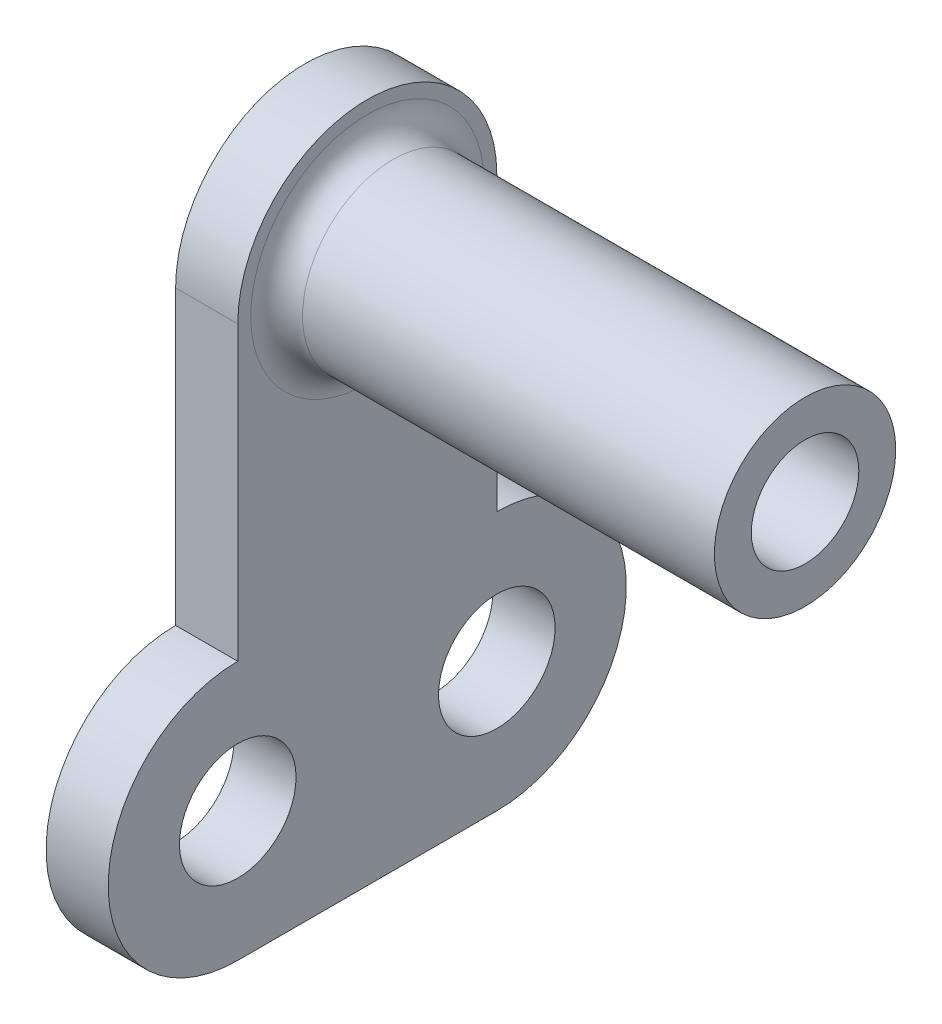
from build123d import *

# Parameters (mm, degrees)
SKETCH_1_R      = 2.25
SKETCH_1_R_2    = 2.075
EXTRUDE_1_DEPTH = 2.4
SKETCH_4_R      = 3.5
SKETCH_4_R_2    = 2.075
EXTRUDE_2_DEPTH = 16.9
FILLET_1_R      = 1
SKETCH_5_R      = 2.075
SKETCH_5_R_2    = 1.2
EXTRUDE_3_DEPTH = 4


with BuildPart() as part:
    # 草图1 → 凸台-拉伸1 (new body)
    with BuildSketch(Plane(origin=(0, 0, 0), x_dir=(0, 0, -1), z_dir=(1, 0, 0))):
        with BuildLine():
            Line((-5, 0), (5, 0))
            ThreePointArc((5, 0), (10, 5), (5, 10))
            Line((5, 10), (5, 21.282156306))
            ThreePointArc((5, 21.282156306), (0, 26.282156306), (-5, 21.282156306))
            Line((-5, 21.282156306), (-5, 10))
            ThreePointArc((-5, 10), (-10, 5), (-5, 0))
        make_face()
        with Locations((-5, 5)):
            Circle(SKETCH_1_R, mode=Mode.SUBTRACT)
        with Locations((5, 5)):
            Circle(SKETCH_1_R, mode=Mode.SUBTRACT)
        with Locations((0, 21.282156306)):
            Circle(SKETCH_1_R_2, mode=Mode.SUBTRACT)
    extrude(amount=EXTRUDE_1_DEPTH)

    # 草图4 → 凸台-拉伸2 (add)
    with BuildSketch(Plane(origin=(2.4, 0, 0), x_dir=(0, 0, -1), z_dir=(1, 0, 0))):
        with Locations((0, 21.282156306)):
            Circle(SKETCH_4_R)
        with Locations((0, 21.282156306)):
            Circle(SKETCH_4_R_2, mode=Mode.SUBTRACT)
    extrude(amount=EXTRUDE_2_DEPTH)

    # 圆角1
    fillet_1_edges = [part.edges().sort_by_distance(p)[0] for p in [
        (2.4, 21.282156306, 3.5),
    ]]
    fillet(fillet_1_edges, radius=FILLET_1_R)

    # 草图5 → 凸台-拉伸3 (add)
    with BuildSketch(Plane.ZY):
        with Locations((0, 21.282156306)):
            Circle(SKETCH_5_R)
        with Locations((0, 21.282156306)):
            Circle(SKETCH_5_R_2, mode=Mode.SUBTRACT)
    extrude(amount=-EXTRUDE_3_DEPTH)


solid = part.part
